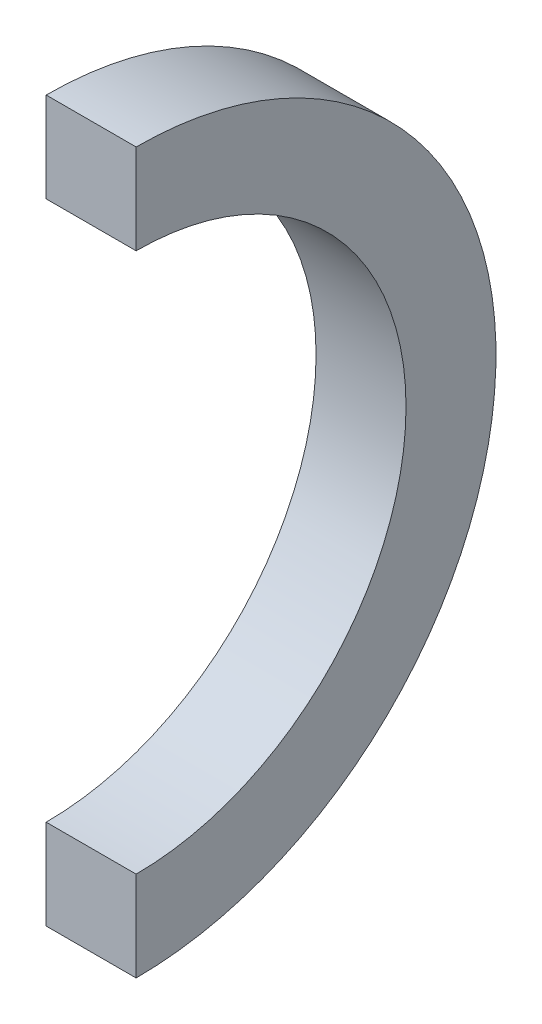
from build123d import *

# Parameters (mm, degrees)
SKETCH1_W      = 25.4
SKETCH1_H      = 25.4
REVOLVE1_ANGLE = 180


with BuildPart() as part:
    # Sketch1 → Revolve1 (revolve)
    with BuildSketch(Plane.XY):
        with Locations((-12.7, 12.7)):
            Rectangle(SKETCH1_W, SKETCH1_H)
    revolve(axis=Axis((-25.4, 101.6, 0), (1, 0, 0)), revolution_arc=REVOLVE1_ANGLE)


solid = part.part
